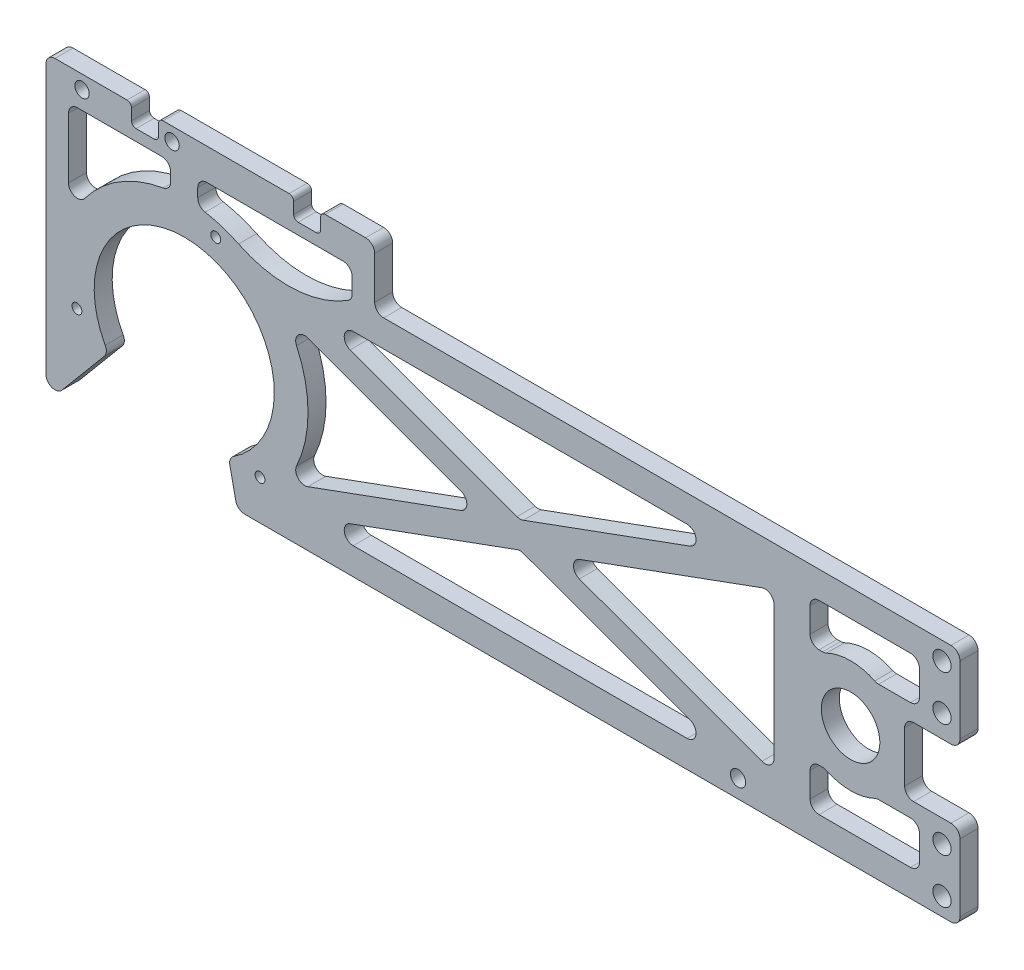
from build123d import *

# Parameters (mm, degrees)
SKETCH_1_W                   = 200
SKETCH_1_H                   = 53.2
SKETCH_1_R                   = 6.5
SKETCH_1_R_2                 = 2.025
EXTRUDE_1_DEPTH              = 2
SKETCH_2_R                   = 20
CUT_EXTRUDE_1_DEPTH          = 5
CUT_EXTRUDE_2_DEPTH          = 10
SKETCH_4_R                   = 1.1
CUT_EXTRUDE_3_DEPTH          = 10
SKETCH_5_W                   = 70
SKETCH_5_H                   = 13.4
SKETCH_5_R                   = 1.6
EXTRUDE_2_DEPTH              = 4
EXTRUDE_3_DEPTH              = 4
SKETCH_7_W                   = 12.3
SKETCH_7_H                   = 15.2
CUT_EXTRUDE_4_DEPTH          = 10
CUT_EXTRUDE_5_DEPTH          = 10
EXTRUDE_1_2_DEPTH            = 4
SKETCH_10_R                  = 1.1
CUT_EXTRUDE_6_DEPTH          = 4
FILLET_1_R                   = 2
CUT_EXTRUDE_7_DEPTH          = 4
FILLET_2_R                   = 2
SKETCH_12_R                  = 1.55
CUT_EXTRUDE_8_DEPTH          = 10
HOLE_WIZARD_M3_1_D           = 3.4
HOLE_WIZARD_M3_1_CSINK_D     = 6.3
HOLE_WIZARD_M3_1_CSINK_ANGLE = 90
SKETCH_16_W                  = 6
SKETCH_16_H                  = 4.5
CUT_EXTRUDE_9_DEPTH          = 10
FILLET_3_R                   = 1


with BuildPart() as part:
    # 草图1 → Extrude 1 (new, symmetric)
    with BuildSketch(Plane.XY):
        with Locations((-75.7, 0)):
            Rectangle(SKETCH_1_W, SKETCH_1_H)
        Circle(SKETCH_1_R, mode=Mode.SUBTRACT)
        with Locations((20.3, 22.6)):
            Circle(SKETCH_1_R_2, mode=Mode.SUBTRACT)
        with Locations((20.3, 12.6)):
            Circle(SKETCH_1_R_2, mode=Mode.SUBTRACT)
        with Locations((20.3, -12.6)):
            Circle(SKETCH_1_R_2, mode=Mode.SUBTRACT)
        with Locations((20.3, -22.6)):
            Circle(SKETCH_1_R_2, mode=Mode.SUBTRACT)
    extrude(amount=EXTRUDE_1_DEPTH, both=True)

    # 草图2 → 切除-拉伸1 (cut)
    with BuildSketch(Plane.XY.offset(2)):
        with Locations((-148, 0)):
            Circle(SKETCH_2_R)
    extrude(amount=-CUT_EXTRUDE_1_DEPTH, mode=Mode.SUBTRACT)

    # 草图3 → 切除-拉伸2 (cut)
    with BuildSketch(Plane.XY.offset(2)):
        with BuildLine():
            Line((-136.21195189, -26.6), (-139.272801212, -12.199836119))
            ThreePointArc((-139.272801212, -12.199836119), (-151.628828434, -14.554435894), (-161.43313529, -6.674644281))
            Line((-161.43313529, -6.674644281), (-175.7, -23.677231554))
            Line((-175.7, -23.677231554), (-175.7, -26.6))
            Line((-175.7, -26.6), (-136.21195189, -26.6))
        make_face()
    extrude(amount=-CUT_EXTRUDE_2_DEPTH, mode=Mode.SUBTRACT)

    # 草图4 → 切除-拉伸3 (cut)
    with BuildSketch(Plane.XY.offset(2)):
        with Locations((-141, 23.478713764)):
            Circle(SKETCH_4_R)
        with Locations((-131.166837432, -17.801534708)):
            Circle(SKETCH_4_R)
        with Locations((-171.833162568, -5.677179055)):
            Circle(SKETCH_4_R)
    extrude(amount=-CUT_EXTRUDE_3_DEPTH, mode=Mode.SUBTRACT)

    # 草图5 → 凸台-拉伸2 (add)
    with BuildSketch(Plane.XY.offset(2)):
        with Locations((-140.7, 33.3)):
            Rectangle(SKETCH_5_W, SKETCH_5_H)
        with Locations((-170.7, 37)):
            Circle(SKETCH_5_R, mode=Mode.SUBTRACT)
        with Locations((-150.7, 37)):
            Circle(SKETCH_5_R, mode=Mode.SUBTRACT)
    extrude(amount=-EXTRUDE_2_DEPTH)

    # 草图6 → 凸台-拉伸3 (add)
    with BuildSketch(Plane.XY.offset(2)):
        Polygon((-175.7, 40), (-178.7, 40), (-178.7, -27.252492331), (-175.7, -23.677231554), align=None)
    extrude(amount=-EXTRUDE_3_DEPTH)

    # 草图7 → 切除-拉伸4 (cut)
    with BuildSketch(Plane.XY.offset(2)):
        with Locations((18.15, 0)):
            Rectangle(SKETCH_7_W, SKETCH_7_H)
        with BuildLine():
            Line((15.3, -11.1), (5.748043145, -11.1))
            ThreePointArc((5.748043145, -11.1), (0, -12.5), (-5.748043145, -11.1))
            Line((-5.748043145, -11.1), (-9, -11.1))
            Line((-9, -11.1), (-9, -20.6))
            Line((-9, -20.6), (15.3, -20.6))
            Line((15.3, -20.6), (15.3, -11.1))
        make_face()
        with BuildLine():
            ThreePointArc((-5.748043145, 11.1), (0, 12.5), (5.748043145, 11.1))
            Line((5.748043145, 11.1), (15.3, 11.1))
            Line((15.3, 11.1), (15.3, 20.6))
            Line((15.3, 20.6), (-9, 20.6))
            Line((-9, 20.6), (-9, 11.1))
            Line((-9, 11.1), (-5.748043145, 11.1))
        make_face()
    extrude(amount=-CUT_EXTRUDE_4_DEPTH, mode=Mode.SUBTRACT)

    # 草图8 → 切除-拉伸5 (cut)
    with BuildSketch(Plane.XY.offset(2)):
        with BuildLine():
            Line((-17, -20.6), (-129.782151609, -20.6))
            ThreePointArc((-129.782151609, -20.6), (-120.5, 0), (-129.782151609, 20.6))
            Line((-129.782151609, 20.6), (-17, 20.6))
            Line((-17, 20.6), (-17, -20.6))
        make_face()
    extrude(amount=-CUT_EXTRUDE_5_DEPTH, mode=Mode.SUBTRACT)

    # 草图9 → Extrude 1 2 (add)
    with BuildSketch(Plane.XY.offset(2)):
        Polygon((-16.056398464, -18.016956032), (-128.838550073, 23.183043968), (-130.725753145, 18.016956032), (-17.943601536, -23.183043968), align=None)
        Polygon((-17.943601536, 23.183043968), (-130.725753145, -18.016956032), (-128.838550073, -23.183043968), (-16.056398464, 18.016956032), align=None)
    extrude(amount=-EXTRUDE_1_2_DEPTH)

    # 草图10 → 切除-拉伸6 (cut)
    with BuildSketch(Plane.XY.offset(2)):
        with Locations((-131.166837432, -17.801534708)):
            Circle(SKETCH_10_R)
    extrude(amount=-CUT_EXTRUDE_6_DEPTH, mode=Mode.SUBTRACT)

    # 圆角1
    fillet_1_edges = [part.edges().sort_by_distance(p)[0] for p in [
        (-178.7, -27.252492331, 0),
        (-178.7, 40, 0),
        (24.3, -7.6, 0),
        (24.3, 7.6, 0),
        (-5.748043145, -11.1, 0),
        (5.748043145, -11.1, 0),
        (15.3, -11.1, 0),
        (15.3, -20.6, 0),
        (-9, -20.6, 0),
        (-9, -11.1, 0),
        (5.748043145, 11.1, 0),
        (-5.748043145, 11.1, 0),
        (-9, 11.1, 0),
        (-9, 20.6, 0),
        (15.3, 20.6, 0),
        (15.3, 11.1, 0),
        (12, -7.6, 0),
        (12, 7.6, 0),
        (-25.014505818, 20.6, 0),
        (-121.767645791, 20.6, 0),
        (-125.787682754, -16.213049144, 0),
        (-125.787682754, 16.213049144, 0),
        (-121.767645791, -20.6, 0),
        (-25.014505818, -20.6, 0),
        (-17, 17.672252701, 0),
        (-17, -17.672252701, 0),
        (-65.376569986, 0, 0),
        (-73.391075804, -2.927747299, 0),
        (-81.405581623, 0, 0),
        (-73.391075804, 2.927747299, 0),
        (-164.85987264, -10.758470828, 0),
        (-138.16441215, -17.414396677, 0),
        (-136.21195189, -26.6, 0),
        (24.3, 26.6, 0),
        (24.3, -26.6, 0),
        (-105.7, 40, 0),
        (-105.7, 26.6, 0),
    ]]
    fillet(fillet_1_edges, radius=FILLET_1_R)

    # 草图11 → 切除-拉伸7 (cut)
    with BuildSketch(Plane.XY.offset(2)):
        with BuildLine():
            Line((-110.7, 26.6), (-110.7, 33))
            Line((-110.7, 33), (-145, 33))
            Line((-145, 33), (-145, 27.335873866))
            ThreePointArc((-145, 27.335873866), (-140.342710532, 26.412419768), (-135.913677776, 24.701635879))
            ThreePointArc((-135.913677776, 24.701635879), (-123.049148512, 22.228227917), (-110.7, 26.6))
        make_face()
        with BuildLine():
            Line((-173.7, 33), (-151, 33))
            Line((-151, 33), (-151, 27.335873866))
            ThreePointArc((-151, 27.335873866), (-164.82036316, 21.756042452), (-173.7, 9.785703858))
            Line((-173.7, 9.785703858), (-173.7, 33))
        make_face()
    extrude(amount=-CUT_EXTRUDE_7_DEPTH, mode=Mode.SUBTRACT)

    # 圆角2
    fillet_2_edges = [part.edges().sort_by_distance(p)[0] for p in [
        (-110.7, 26.6, 0),
        (-145, 27.335873866, 0),
        (-145, 33, 0),
        (-110.7, 33, 0),
        (-173.7, 9.785703858, 0),
        (-173.7, 33, 0),
        (-151, 33, 0),
        (-151, 27.335873866, 0),
    ]]
    fillet(fillet_2_edges, radius=FILLET_2_R)

    # 草图12 → 切除-拉伸8 (cut)
    with BuildSketch(Plane.XY.offset(2)):
        with Locations((-25, -22.6)):
            Circle(SKETCH_12_R)
    extrude(amount=-CUT_EXTRUDE_8_DEPTH, mode=Mode.SUBTRACT)

    # M3 锥坑平头螺钉的锥形沉头孔1 (through all)
    with Locations(Plane(origin=(0, 0, -2), x_dir=(-1, 0, 0), z_dir=(0, 0, -1))):
        with Locations((25, -22.6)):
            CounterSinkHole(HOLE_WIZARD_M3_1_D / 2, HOLE_WIZARD_M3_1_CSINK_D / 2, counter_sink_angle=HOLE_WIZARD_M3_1_CSINK_ANGLE)

    # 草图16 → 切除-拉伸9 (cut)
    with BuildSketch(Plane.XY.offset(2)):
        with Locations((-120.7, 37.75)):
            Rectangle(SKETCH_16_W, SKETCH_16_H)
        with Locations((-156.7, 37.75)):
            Rectangle(SKETCH_16_W, SKETCH_16_H)
    extrude(amount=-CUT_EXTRUDE_9_DEPTH, mode=Mode.SUBTRACT)

    # 圆角3
    fillet_3_edges = [part.edges().sort_by_distance(p)[0] for p in [
        (-153.7, 40, 0),
        (-159.7, 40, 0),
        (-117.7, 40, 0),
        (-123.7, 40, 0),
        (-117.7, 35.5, 0),
        (-123.7, 35.5, 0),
        (-153.7, 35.5, 0),
        (-159.7, 35.5, 0),
    ]]
    fillet(fillet_3_edges, radius=FILLET_3_R)


solid = part.part
